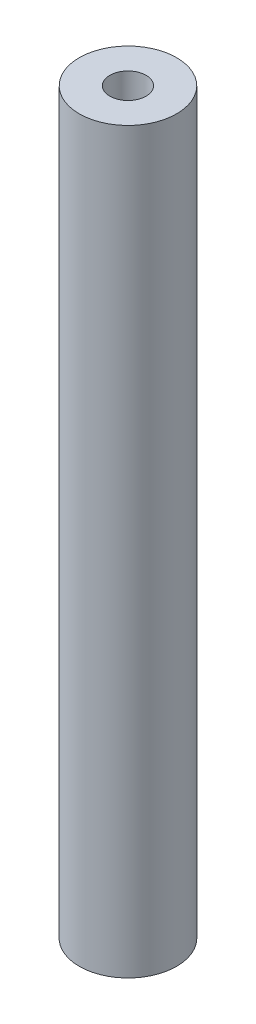
from build123d import *

# Parameters (mm, degrees)
SKETCH1_R           = 7.25
BOSS_EXTRUDE1_DEPTH = 110
SKETCH2_R           = 2.7
CUT_EXTRUDE1_DEPTH  = 110


with BuildPart() as part:
    # Sketch1 → Boss-Extrude1 (new body)
    with BuildSketch(Plane(origin=(0, 0, 0), x_dir=(1, 0, 0), z_dir=(0, 1, 0))):
        with Locations(Location((0, 0, 0), (0, 0, 270))):
            Circle(SKETCH1_R)
    extrude(amount=BOSS_EXTRUDE1_DEPTH)

    # Sketch2 → Cut-Extrude1 (cut)
    with BuildSketch(Plane(origin=(0, 110, 0), x_dir=(1, 0, 0), z_dir=(0, 1, 0))):
        with Locations(Location((0, 0, 0), (0, 0, 270))):
            Circle(SKETCH2_R)
    extrude(amount=-CUT_EXTRUDE1_DEPTH, mode=Mode.SUBTRACT)


solid = part.part
